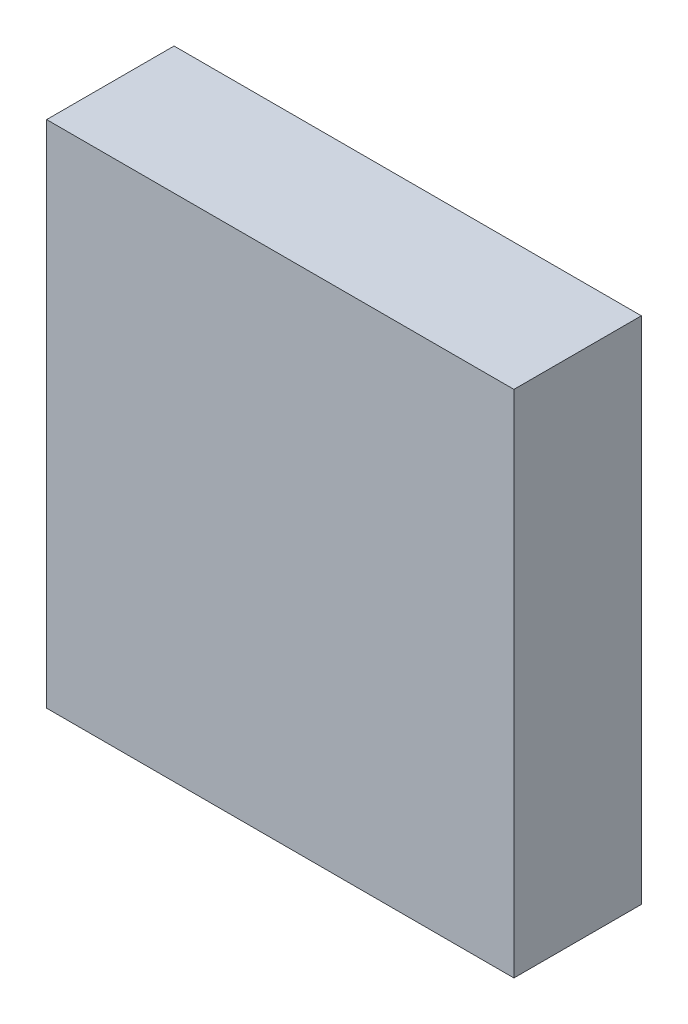
from build123d import *

# Parameters (mm, degrees)
SKETCH1_W           = 11
SKETCH1_H           = 12
BOSS_EXTRUDE1_DEPTH = 3


with BuildPart() as part:
    # Sketch1 → Boss-Extrude1 (new body)
    with BuildSketch(Plane.XY):
        Rectangle(SKETCH1_W, SKETCH1_H)
    extrude(amount=BOSS_EXTRUDE1_DEPTH)


solid = part.part
